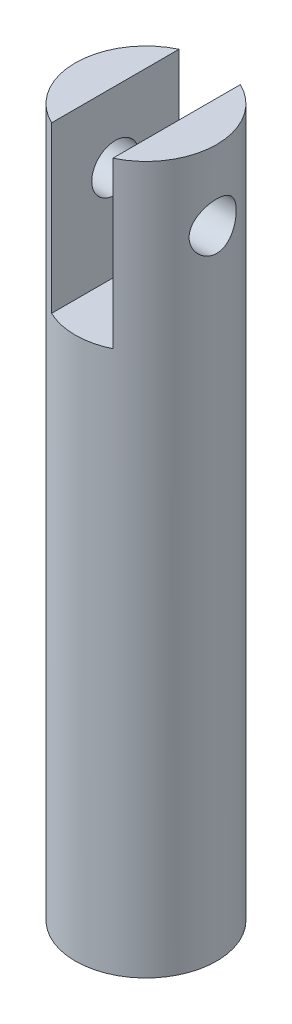
from build123d import *

# Parameters (mm, degrees)
SKETCH_1_R               = 3
EXTRUDE_1_DEPTH          = 30
SKETCH_2_W               = 2.6
SKETCH_2_H               = 6.217658974
CUT_EXTRUDE_1_DEPTH      = 7
CUT_EXTRUDE_3_DEPTH      = 31.454720488
CUT_EXTRUDE_3_DEPTH_BACK = 31.454720488
SKETCH_3_R               = 1


with BuildPart() as part:
    # 草图1 → 凸台-拉伸1 (new body)
    with BuildSketch(Plane(origin=(0, 0, 0), x_dir=(1, 0, 0), z_dir=(0, 1, 0))):
        with Locations(Location((0, 0, 0), (0, 0, 270))):
            Circle(SKETCH_1_R)
    extrude(amount=EXTRUDE_1_DEPTH)

    # 草图2 → 切除-拉伸1 (cut)
    with BuildSketch(Plane(origin=(0, 30, 0), x_dir=(1, 0, 0), z_dir=(0, 1, 0))):
        Rectangle(SKETCH_2_W, SKETCH_2_H)
    extrude(amount=-CUT_EXTRUDE_1_DEPTH, mode=Mode.SUBTRACT)

    # 草图3 → 切除-拉伸3 (cut, two sides: drawn at the far end of the back side and taken through both)
    with BuildSketch(Plane.ZY.offset(-1.3).offset(-CUT_EXTRUDE_3_DEPTH_BACK)):
        with Locations((0, 27)):
            Circle(SKETCH_3_R)
    extrude(amount=CUT_EXTRUDE_3_DEPTH + CUT_EXTRUDE_3_DEPTH_BACK, mode=Mode.SUBTRACT)


solid = part.part
